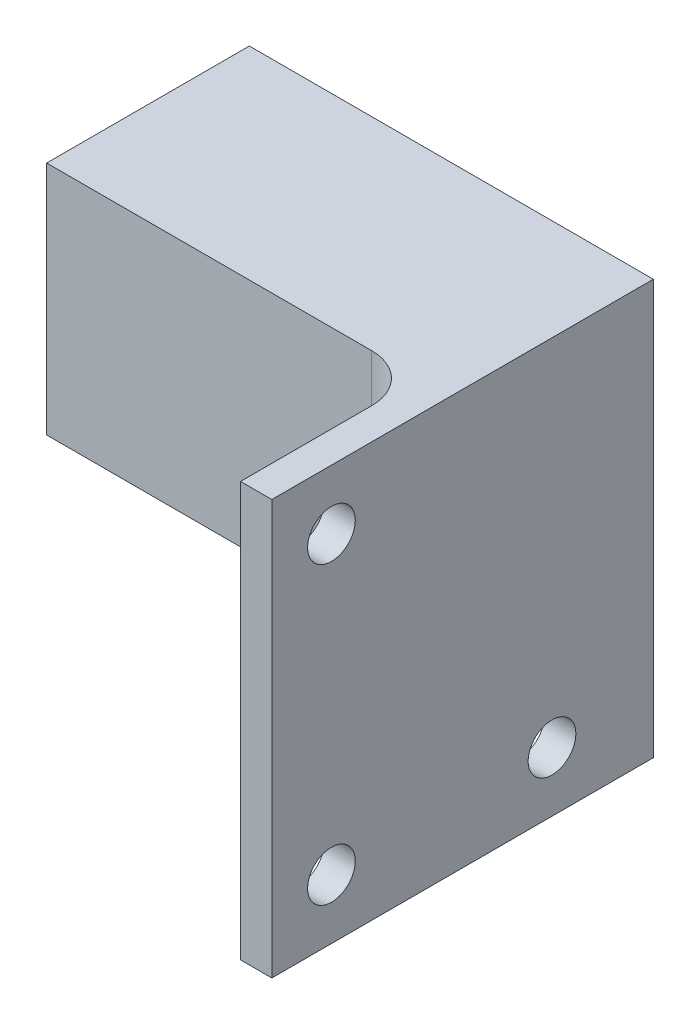
from build123d import *

# Parameters (mm, degrees)
SKETCH2_W           = 33.887326606
SKETCH2_H           = 19.760086797
BOSS_EXTRUDE1_DEPTH = 15
SKETCH3_W           = 33.887326606
SKETCH3_H           = 19.760086797
BOSS_EXTRUDE2_DEPTH = 2
SKETCH6_W           = 32
SKETCH6_H           = 34.760086797
SKETCH6_R           = 2
BOSS_EXTRUDE4_DEPTH = 2.624753
FILLET1_R           = 4


with BuildPart() as part:
    # Sketch2 → Boss-Extrude1 (new body)
    with BuildSketch(Plane.XY):
        with Locations((0, -7.586628603)):
            Rectangle(SKETCH2_W, SKETCH2_H)
        with BuildLine():
            Line((0, 0), (14.318912319, -14.318912319))
            Line((14.318912319, -14.318912319), (12.833988079, -15.80383656))
            Line((12.833988079, -15.80383656), (1.060660172, -4.030508653))
            ThreePointArc((1.060660172, -4.030508653), (0, -3.591168825), (-1.060660172, -4.030508653))
            Line((-1.060660172, -4.030508653), (-12.833988079, -15.80383656))
            Line((-12.833988079, -15.80383656), (-14.318912319, -14.318912319))
            Line((-14.318912319, -14.318912319), (0, 0))
        make_face(mode=Mode.SUBTRACT)
    extrude(amount=BOSS_EXTRUDE1_DEPTH)

    # Sketch3 → Boss-Extrude2 (add)
    with BuildSketch(Plane.XY.offset(15)):
        with Locations((0, -7.586628603)):
            Rectangle(SKETCH3_W, SKETCH3_H)
    extrude(amount=BOSS_EXTRUDE2_DEPTH)

    # Sketch6 → Boss-Extrude4 (add)
    with BuildSketch(Plane(origin=(16.943663303, 0, 0), x_dir=(0, 0, -1), z_dir=(1, 0, 0))):
        with Locations((-16, -15.086628602)):
            Rectangle(SKETCH6_W, SKETCH6_H)
        with Locations((-8.5, -27.466672001)):
            Circle(SKETCH6_R, mode=Mode.SUBTRACT)
        with Locations((-27, -27.466672001)):
            Circle(SKETCH6_R, mode=Mode.SUBTRACT)
        with Locations((-27, -2.706585204)):
            Circle(SKETCH6_R, mode=Mode.SUBTRACT)
    extrude(amount=-BOSS_EXTRUDE4_DEPTH)

    # Fillet1
    fillet1_edges = [part.edges().sort_by_distance(p)[0] for p in [
        (14.318910303, -7.586628602, 17),
        (14.318910303, -17.466672001, 8.5),
    ]]
    fillet(fillet1_edges, radius=FILLET1_R)


solid = part.part
